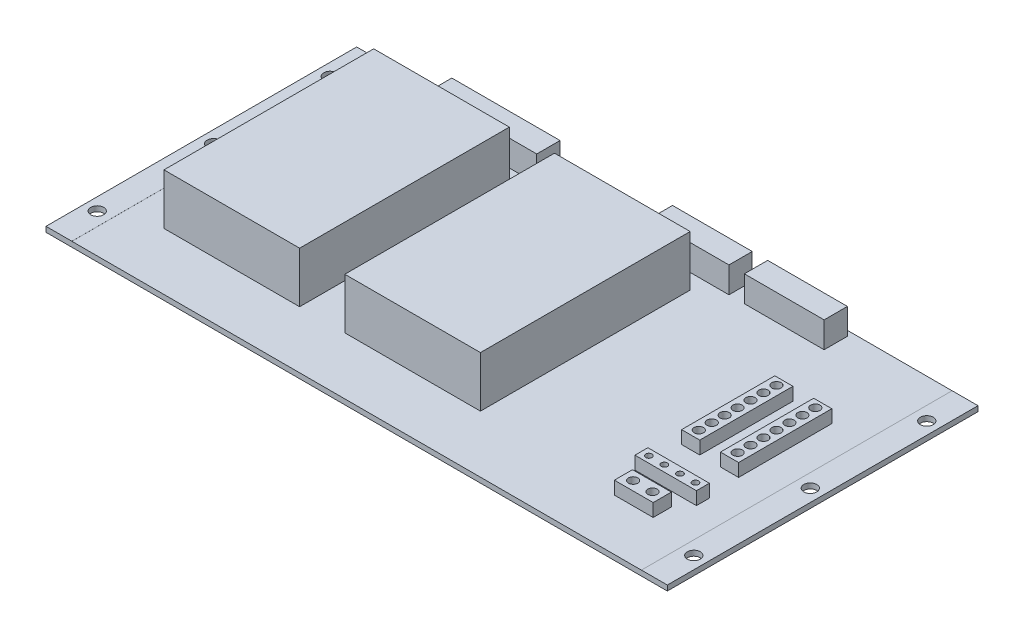
from build123d import *

# Parameters (mm, degrees)
SKETCH1_W              = 304.8
SKETCH1_H              = 152.4
SKETCH1_R              = 3.175
BOARD_DEPTH            = 2.54
SKETCH2_W              = 66.548
SKETCH2_H              = 102.87
ACCELNET_DEPTH         = 24.892
SKETCH3_W              = 53.086
SKETCH3_H              = 11.43
D25TOCOMPUTER_DEPTH    = 12.7
SKETCH5_W              = 39.116
SKETCH5_H              = 11.43
D15TOMOTOR_BRAKE_DEPTH = 12.7
SKETCH7_W              = 19.05
SKETCH7_H              = 8.89
SKETCH7_R              = 2.286
SKETCH7_W_2            = 30.175587071
SKETCH7_H_2            = 6.35
SKETCH7_R_2            = 1.524
HVIN_24VIN_5VIN_DEPTH  = 6.35
SKETCH9_W              = 8.89
SKETCH9_H              = 45.72
SKETCH9_R              = 2.286
MOTORS_BRAKES_DEPTH    = 6.35
SKETCH10_W             = 12.7
SKETCH10_H             = 152.4
SKETCH10_R             = 3.175
PLATEDEDGE_DEPTH       = 0.0254


with BuildPart() as part:
    # Sketch1 → Board (new body)
    with BuildSketch(Plane(origin=(0, 0, 0), x_dir=(1, 0, 0), z_dir=(0, 1, 0))):
        with Locations((152.4, 76.2)):
            Rectangle(SKETCH1_W, SKETCH1_H)
        with Locations(Location((298.731278283, 76.2, 0), (0, 0, 270))):
            Circle(SKETCH1_R, mode=Mode.SUBTRACT)
        with Locations(Location((298.731278283, 133.35, 0), (0, 0, 270))):
            Circle(SKETCH1_R, mode=Mode.SUBTRACT)
        with Locations(Location((298.731278283, 19.05, 0), (0, 0, 90))):
            Circle(SKETCH1_R, mode=Mode.SUBTRACT)
        with Locations(Location((6.068721717, 19.05, 0), (0, 0, 270))):
            Circle(SKETCH1_R, mode=Mode.SUBTRACT)
        with Locations(Location((6.068721717, 76.2, 0), (0, 0, 90))):
            Circle(SKETCH1_R, mode=Mode.SUBTRACT)
        with Locations(Location((6.068721717, 133.35, 0), (0, 0, 90))):
            Circle(SKETCH1_R, mode=Mode.SUBTRACT)
    extrude(amount=BOARD_DEPTH)

    # Sketch2 → Accelnet (add)
    with BuildSketch(Plane(origin=(0, 2.54, 0), x_dir=(-1, 0, 0), z_dir=(0, 1, 0))):
        with Locations((-63.093174763, -79.48542652)):
            Rectangle(SKETCH2_W, SKETCH2_H)
        with Locations((-151.798661476, -79.48542652)):
            Rectangle(SKETCH2_W, SKETCH2_H)
    extrude(amount=ACCELNET_DEPTH)

    # Sketch3 → D25toComputer (add)
    with BuildSketch(Plane(origin=(0, 2.54, 0), x_dir=(-1, 0, 0), z_dir=(0, 1, 0))):
        with Locations((-75.767610713, -144.145)):
            Rectangle(SKETCH3_W, SKETCH3_H)
    extrude(amount=D25TOCOMPUTER_DEPTH)

    # Sketch5 → D15toMotor/Brake (add)
    with BuildSketch(Plane(origin=(0, 2.54, 0), x_dir=(-1, 0, 0), z_dir=(0, 1, 0))):
        with Locations((-177.038519959, -144.145)):
            Rectangle(SKETCH5_W, SKETCH5_H)
        with Locations((-223.715302991, -144.145)):
            Rectangle(SKETCH5_W, SKETCH5_H)
    extrude(amount=D15TOMOTOR_BRAKE_DEPTH)

    # Sketch7 → HVin/24Vin/5Vin (add)
    # profile 1 of 2: a face of its own
    with BuildSketch(Plane(origin=(0, 2.54, 0), x_dir=(-1, 0, 0), z_dir=(0, 1, 0))):
        with Locations((-263.099763315, -29.684886318)):
            Rectangle(SKETCH7_W, SKETCH7_H)
        with Locations(Location((-258.354389381, -29.684886318, 0), (0, 0, 90))):
            Circle(SKETCH7_R, mode=Mode.SUBTRACT)
        with Locations(Location((-267.845137249, -29.684886318, 0), (0, 0, 270))):
            Circle(SKETCH7_R, mode=Mode.SUBTRACT)
    # profile 2 of 2: a face of its own
    with BuildSketch(Plane(origin=(0, 2.54, 0), x_dir=(-1, 0, 0), z_dir=(0, 1, 0))):
        with Locations((-263.099763315, -44.067178792)):
            Rectangle(SKETCH7_W_2, SKETCH7_H_2)
        with Locations(Location((-266.938051441, -44.067178792, 0), (0, 0, 90))):
            Circle(SKETCH7_R_2, mode=Mode.SUBTRACT)
        with Locations(Location((-274.531114606, -44.067178792, 0), (0, 0, 270))):
            Circle(SKETCH7_R_2, mode=Mode.SUBTRACT)
        with Locations(Location((-251.668412024, -44.067178792, 0), (0, 0, 90))):
            Circle(SKETCH7_R_2, mode=Mode.SUBTRACT)
        with Locations(Location((-259.261475189, -44.067178792, 0), (0, 0, 270))):
            Circle(SKETCH7_R_2, mode=Mode.SUBTRACT)
    extrude(amount=HVIN_24VIN_5VIN_DEPTH)

    # Sketch9 → Motors/Brakes (add)
    # profile 1 of 2: a face of its own
    with BuildSketch(Plane(origin=(0, 2.54, 0), x_dir=(-1, 0, 0), z_dir=(0, 1, 0))):
        with Locations((-272.10570634, -86.062744457)):
            Rectangle(SKETCH9_W, SKETCH9_H)
        with Locations(Location((-272.10570634, -73.524162022, 0), (0, 0, 90))):
            Circle(SKETCH9_R, mode=Mode.SUBTRACT)
        with Locations(Location((-272.10570634, -67.174162022, 0), (0, 0, 90))):
            Circle(SKETCH9_R, mode=Mode.SUBTRACT)
        with Locations(Location((-272.10570634, -86.224162022, 0), (0, 0, 90))):
            Circle(SKETCH9_R, mode=Mode.SUBTRACT)
        with Locations(Location((-272.10570634, -79.874162022, 0), (0, 0, 90))):
            Circle(SKETCH9_R, mode=Mode.SUBTRACT)
        with Locations(Location((-272.10570634, -98.924162022, 0), (0, 0, 90))):
            Circle(SKETCH9_R, mode=Mode.SUBTRACT)
        with Locations(Location((-272.10570634, -92.574162022, 0), (0, 0, 90))):
            Circle(SKETCH9_R, mode=Mode.SUBTRACT)
        with Locations(Location((-272.10570634, -105.274162022, 0), (0, 0, 90))):
            Circle(SKETCH9_R, mode=Mode.SUBTRACT)
    # profile 2 of 2: a face of its own
    with BuildSketch(Plane(origin=(0, 2.54, 0), x_dir=(-1, 0, 0), z_dir=(0, 1, 0))):
        with Locations((-253.05570634, -86.062744457)):
            Rectangle(SKETCH9_W, SKETCH9_H)
        with Locations(Location((-253.05570634, -79.874162022, 0), (0, 0, 90))):
            Circle(SKETCH9_R, mode=Mode.SUBTRACT)
        with Locations(Location((-253.05570634, -67.174162022, 0), (0, 0, 90))):
            Circle(SKETCH9_R, mode=Mode.SUBTRACT)
        with Locations(Location((-253.05570634, -98.924162022, 0), (0, 0, 90))):
            Circle(SKETCH9_R, mode=Mode.SUBTRACT)
        with Locations(Location((-253.05570634, -105.274162022, 0), (0, 0, 90))):
            Circle(SKETCH9_R, mode=Mode.SUBTRACT)
        with Locations(Location((-253.05570634, -73.524162022, 0), (0, 0, 90))):
            Circle(SKETCH9_R, mode=Mode.SUBTRACT)
        with Locations(Location((-253.05570634, -86.224162022, 0), (0, 0, 90))):
            Circle(SKETCH9_R, mode=Mode.SUBTRACT)
        with Locations(Location((-253.05570634, -92.574162022, 0), (0, 0, 90))):
            Circle(SKETCH9_R, mode=Mode.SUBTRACT)
    extrude(amount=MOTORS_BRAKES_DEPTH)

    # Sketch10 → platedEdge (add)
    # profile 1 of 2: a face of its own
    with BuildSketch(Plane(origin=(0, 2.54, 0), x_dir=(-1, 0, 0), z_dir=(0, 1, 0))):
        with Locations((-298.45, -76.2)):
            Rectangle(SKETCH10_W, SKETCH10_H)
        with Locations(Location((-298.731278283, -133.35, 0), (0, 0, 90))):
            Circle(SKETCH10_R, mode=Mode.SUBTRACT)
        with Locations(Location((-298.731278283, -76.2, 0), (0, 0, 90))):
            Circle(SKETCH10_R, mode=Mode.SUBTRACT)
        with Locations(Location((-298.731278283, -19.05, 0), (0, 0, 270))):
            Circle(SKETCH10_R, mode=Mode.SUBTRACT)
    # profile 2 of 2: a face of its own
    with BuildSketch(Plane(origin=(0, 2.54, 0), x_dir=(-1, 0, 0), z_dir=(0, 1, 0))):
        with Locations((-6.35, -76.2)):
            Rectangle(SKETCH10_W, SKETCH10_H)
        with Locations(Location((-6.068721717, -19.05, 0), (0, 0, 90))):
            Circle(SKETCH10_R, mode=Mode.SUBTRACT)
        with Locations(Location((-6.068721717, -76.2, 0), (0, 0, 270))):
            Circle(SKETCH10_R, mode=Mode.SUBTRACT)
        with Locations(Location((-6.068721717, -133.35, 0), (0, 0, 270))):
            Circle(SKETCH10_R, mode=Mode.SUBTRACT)
    extrude(amount=PLATEDEDGE_DEPTH)


solid = part.part
